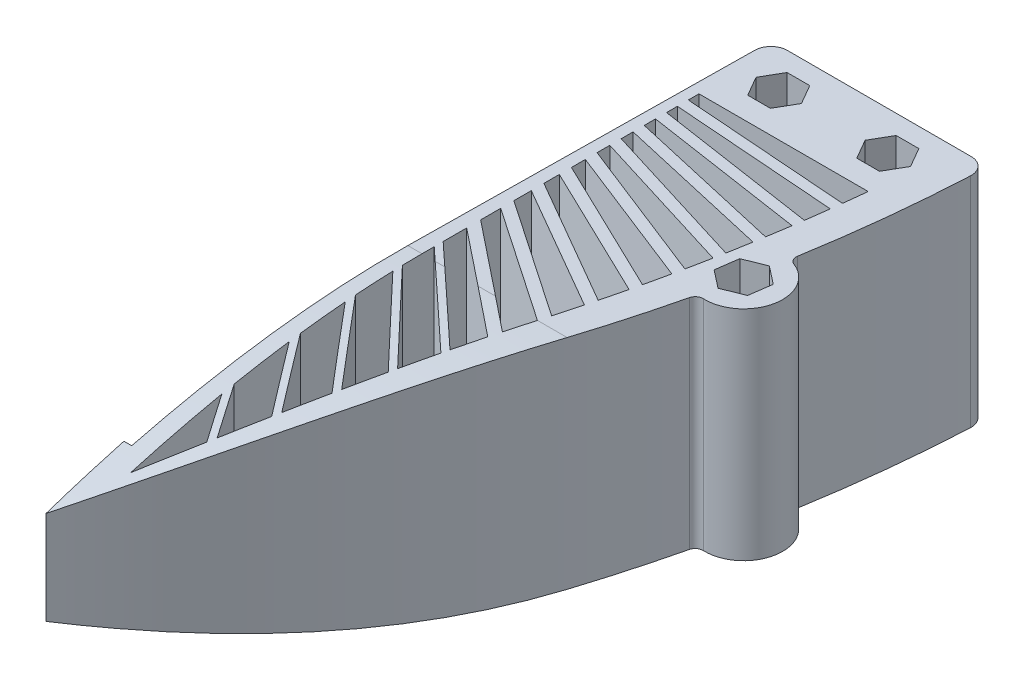
from build123d import *

# Parameters (mm, degrees)
SKETCH_3_R          = 2
EXTRUDE_2_DEPTH     = 40
SCALE_2_SCALE       = 0.7
EXTRUDE_START       = -28
EXTRUDE_3_DEPTH     = 28
SKETCH_6_R          = 1.5
CUT_EXTRUDE_4_DEPTH = 30
SKETCH_9_R          = 1.5
EXTRUDE_5_DEPTH     = 28
EXTRUDE_6_DEPTH     = 28
SKETCH_12_R         = 1.5
CUT_EXTRUDE_6_DEPTH = 37
CUT_EXTRUDE_8_DEPTH = 30
FILLET_1_R          = 1
CUT_EXTRUDE_7_DEPTH = 37


with BuildPart() as part:
    # 草图3 → 凸台-拉伸2 (new body)
    with BuildSketch(Plane(origin=(0, 0, 0), x_dir=(1, 0, 0), z_dir=(0, 1, 0))):
        with BuildLine():
            Line((0, 120.364670388), (0, 1))
            ThreePointArc((0, 1), (0.722246327, 0.039347671), (1.845705794, 0.466350574))
            ThreePointArc((1.845705794, 0.466350574), (20.84747072, 37.000481257), (33.527350269, 76.179945644))
            ThreePointArc((33.527350269, 76.179945644), (34.378342968, 77.668130682), (35.905349356, 78.447319216))
            ThreePointArc((35.905349356, 78.447319216), (39.900282258, 82.371073997), (37.749214417, 87.541010902))
            ThreePointArc((37.749214417, 87.541010902), (36.64631247, 88.853447787), (36.44219633, 90.555569958))
            ThreePointArc((36.44219633, 90.555569958), (38.528750421, 105.336074708), (39.720316086, 120.215496736))
            ThreePointArc((39.720316086, 120.215496736), (38.897448554, 122.432577427), (36.724027178, 123.364670388))
            Line((36.724027178, 123.364670388), (3, 123.364670388))
            ThreePointArc((3, 123.364670388), (0.878679656, 122.485990731), (0, 120.364670388))
        make_face()
        with Locations(Location((35, 83.364670388, 0), (0, 0, 270))):
            Circle(SKETCH_3_R, mode=Mode.SUBTRACT)
        with Locations(Location((35, 118.364670388, 0), (0, 0, 270))):
            Circle(SKETCH_3_R, mode=Mode.SUBTRACT)
        with Locations(Location((5, 118.364670388, 0), (0, 0, 270))):
            Circle(SKETCH_3_R, mode=Mode.SUBTRACT)
        with BuildLine():
            Line((6.404592978, 13.516926157), (1.8, 20.887532698))
            Line((1.8, 20.887532698), (1.8, 4.166952556))
            ThreePointArc((1.8, 4.166952556), (4.143731804, 8.821533656), (6.404592978, 13.516926157))
        make_face(mode=Mode.SUBTRACT)
        with BuildLine():
            Line((10.108701369, 21.710284842), (1.8, 33.238427229))
            Line((1.8, 33.238427229), (1.8, 23.152408171))
            Line((1.8, 23.152408171), (7.010340095, 14.812177672))
            ThreePointArc((7.010340095, 14.812177672), (8.581699979, 18.251269202), (10.108701369, 21.710284842))
        make_face(mode=Mode.SUBTRACT)
        with BuildLine():
            Line((13.360943276, 29.512867752), (1.8, 43.503052476))
            Line((1.8, 43.503052476), (1.8, 35.290776631))
            Line((1.8, 35.290776631), (10.66221999, 22.994639198))
            ThreePointArc((10.66221999, 22.994639198), (12.031133738, 26.245658374), (13.360943276, 29.512867752))
        make_face(mode=Mode.SUBTRACT)
        with BuildLine():
            Line((16.223970717, 36.961262948), (1.8, 52.237399724))
            Line((1.8, 52.237399724), (1.8, 45.386862205))
            Line((1.8, 45.386862205), (13.866413905, 30.784994912))
            ThreePointArc((13.866413905, 30.784994912), (15.062552919, 33.866502174), (16.223970717, 36.961262948))
        make_face(mode=Mode.SUBTRACT)
        with BuildLine():
            Line((18.75085734, 44.092608971), (1.8, 59.820076913))
            Line((1.8, 59.820076913), (1.8, 53.985305955))
            Line((1.8, 53.985305955), (16.685267787, 38.220618747))
            ThreePointArc((16.685267787, 38.220618747), (17.733603559, 41.151147004), (18.75085734, 44.092608971))
        make_face(mode=Mode.SUBTRACT)
        with BuildLine():
            Line((20.868191148, 50.566760797), (1.8, 65.772358036))
            Line((1.8, 65.772358036), (1.8, 61.457038549))
            Line((1.8, 61.457038549), (19.171511459, 45.339276238))
            ThreePointArc((19.171511459, 45.339276238), (20.032066674, 47.949053786), (20.868191148, 50.566760797))
        make_face(mode=Mode.SUBTRACT)
        with BuildLine():
            Line((22.974243013, 57.571710343), (1.8, 72.007377378))
            Line((1.8, 72.007377378), (1.8, 68.330403189))
            Line((1.8, 68.330403189), (21.504437212, 52.617442597))
            ThreePointArc((21.504437212, 52.617442597), (22.250225593, 55.091347023), (22.974243013, 57.571710343))
        make_face(mode=Mode.SUBTRACT)
        with BuildLine():
            Line((24.827629624, 64.328957972), (1.8, 77.623370722))
            Line((1.8, 77.623370722), (1.8, 74.427948576))
            Line((1.8, 74.427948576), (23.548915198, 59.600495336))
            ThreePointArc((23.548915198, 59.600495336), (24.198120154, 61.962063537), (24.827629624, 64.328957972))
        make_face(mode=Mode.SUBTRACT)
        with BuildLine():
            Line((26.461878816, 70.885143812), (1.8, 82.761173702))
            Line((1.8, 82.761173702), (1.8, 79.932745943))
            Line((1.8, 79.932745943), (25.345753049, 66.339207891))
            ThreePointArc((25.345753049, 66.339207891), (25.912863392, 68.609954504), (26.461878816, 70.885143812))
        make_face(mode=Mode.SUBTRACT)
        with BuildLine():
            Line((27.903926427, 77.284451229), (1.8, 87.529070114))
            Line((1.8, 87.529070114), (1.8, 84.980988462))
            Line((1.8, 84.980988462), (26.927669734, 72.880655026))
            ThreePointArc((26.927669734, 72.880655026), (27.424243887, 75.080680817), (27.903926427, 77.284451229))
        make_face(mode=Mode.SUBTRACT)
        with BuildLine():
            Line((29.175137635, 83.569053675), (1.8, 92.012833113))
            Line((1.8, 92.012833113), (1.8, 89.677577503))
            Line((1.8, 89.677577503), (28.320844309, 79.269337072))
            ThreePointArc((28.320844309, 79.269337072), (28.756005088, 81.417603081), (29.175137635, 83.569053675))
        make_face(mode=Mode.SUBTRACT)
        with BuildLine():
            Line((30.292091958, 89.779646522), (1.8, 96.282531447))
            Line((1.8, 96.282531447), (1.8, 94.105811431))
            Line((1.8, 94.105811431), (29.545931615, 85.547661697))
            ThreePointArc((29.545931615, 85.547661697), (29.926744008, 87.662290807), (30.292091958, 89.779646522))
        make_face(mode=Mode.SUBTRACT)
        with BuildLine():
            Line((31.267160482, 95.956031632), (1.8, 100.397324466))
            Line((1.8, 100.397324466), (1.8, 98.333961282))
            Line((1.8, 98.333961282), (30.618838123, 91.756501534))
            ThreePointArc((30.618838123, 91.756501534), (30.950586551, 93.855095266), (31.267160482, 95.956031632))
        make_face(mode=Mode.SUBTRACT)
        with BuildLine():
            Line((32.108897466, 102.137737837), (1.8, 104.408991264))
            Line((1.8, 104.408991264), (1.8, 102.419913444))
            Line((1.8, 102.419913444), (31.551287828, 97.935796913))
            ThreePointArc((31.551287828, 97.935796913), (31.837665489, 100.035762437), (32.108897466, 102.137737837))
        make_face(mode=Mode.SUBTRACT)
        with BuildLine():
            Line((32.822260718, 108.364670388), (1.8, 108.364670388))
            Line((1.8, 108.364670388), (1.8, 106.414598935))
            Line((1.8, 106.414598935), (32.351201095, 104.125188036))
            ThreePointArc((32.351201095, 104.125188036), (32.594419706, 106.24407489), (32.822260718, 108.364670388))
        make_face(mode=Mode.SUBTRACT)
        with BuildLine():
            Line((1.8, 110.364670388), (33.02290127, 110.364670388))
            ThreePointArc((33.02290127, 110.364670388), (33.164293245, 111.864318022), (33.298, 113.364670388))
            Line((33.298, 113.364670388), (1.8, 113.364670388))
            Line((1.8, 113.364670388), (1.8, 110.364670388))
        make_face(mode=Mode.SUBTRACT)
    extrude(amount=EXTRUDE_2_DEPTH)


with BuildPart() as part_1:
    # 缩放比例2: scaled about (17.639096178, 20, -80.17321458)
    add(part.part.scale(SCALE_2_SCALE).moved(Location((5.291728853, 6, -24.051964374))))

    # 草图7 → 凸台-拉伸3 (add)
    with BuildSketch(Plane(origin=(0, 34, 0), x_dir=(1, 0, 0), z_dir=(0, 1, 0)).offset(EXTRUDE_START)):
        with BuildLine():
            Line((3.291728853, 19.356429269), (3.291728853, 29.356429269))
            Line((3.291728853, 29.356429269), (4.291728853, 29.356429269))
            Line((4.291728853, 29.356429269), (5.291728853, 108.307233646))
            Line((5.291728853, 108.307233646), (5.291728853, 24.751964374))
            ThreePointArc((5.291728853, 24.751964374), (5.797301282, 24.079507744), (6.583722909, 24.378409776))
            ThreePointArc((6.583722909, 24.378409776), (4.959489095, 21.853153364), (3.291728853, 19.356429269))
        make_face()
    extrude(amount=EXTRUDE_3_DEPTH)

    # 草图6 → 切除-拉伸4 (cut)
    with BuildSketch(Plane(origin=(0, 34, 0), x_dir=(1, 0, 0), z_dir=(0, 1, 0))):
        with Locations(Location((8.791728853, 106.907233646, 0), (0, 0, 270))):
            Circle(SKETCH_6_R)
        with Locations(Location((29.791728853, 106.907233646, 0), (0, 0, 270))):
            Circle(SKETCH_6_R)
        with Locations(Location((29.791728853, 82.407233646, 0), (0, 0, 270))):
            Circle(SKETCH_6_R)
    extrude(amount=-CUT_EXTRUDE_4_DEPTH, mode=Mode.SUBTRACT)

    # 草图9 → 凸台-拉伸5 (add)
    with BuildSketch(Plane(origin=(0, 34, 0), x_dir=(1, 0, 0), z_dir=(0, 1, 0))):
        with Locations((29.791728853, 106.907233646)):
            Circle(SKETCH_9_R)
        with Locations((8.791728853, 106.907233646)):
            Circle(SKETCH_9_R)
    extrude(amount=-EXTRUDE_5_DEPTH)

    # 草图17 → 凸台-拉伸6 (add)
    with BuildSketch(Plane(origin=(0, 34, 0), x_dir=(1, 0, 0), z_dir=(0, 1, 0)).offset(EXTRUDE_START)):
        with BuildLine():
            Line((28.600328853, 103.407233646), (6.551728853, 103.407233646))
            Line((6.551728853, 103.407233646), (6.551728853, 101.307233646))
            Line((6.551728853, 101.307233646), (28.407759742, 101.307233646))
            ThreePointArc((28.407759742, 101.307233646), (28.506734125, 102.35698699), (28.600328853, 103.407233646))
        make_face()
        with BuildLine():
            ThreePointArc((28.7955625, 77.507473183), (34.692011112, 81.413637254), (30.782755009, 87.308036351))
            ThreePointArc((30.782755009, 87.308036351), (30.97180395, 86.188282069), (31.716178945, 85.330672006))
            ThreePointArc((31.716178945, 85.330672006), (33.221926434, 81.711716172), (30.425473403, 78.965087826))
            ThreePointArc((30.425473403, 78.965087826), (29.405838578, 78.465153851), (28.7955625, 77.507473183))
        make_face()
    extrude(amount=EXTRUDE_6_DEPTH)

    # 草图12 → 切除-拉伸6 (cut)
    with BuildSketch(Plane(origin=(0, 34, 0), x_dir=(1, 0, 0), z_dir=(0, 1, 0))):
        with Locations(Location((11.291728853, 105.407233646, 0), (0, 0, 270))):
            Circle(SKETCH_12_R)
        with Locations(Location((25.291728853, 105.407233646, 0), (0, 0, 270))):
            Circle(SKETCH_12_R)
    extrude(amount=-CUT_EXTRUDE_6_DEPTH, mode=Mode.SUBTRACT)

    # 草图18 → 切除-拉伸8 (cut)
    with BuildSketch(Plane(origin=(0, 34, 0), x_dir=(1, 0, 0), z_dir=(0, 1, 0))):
        Polygon((12.749538283, 102.882233646), (14.207347713, 105.407233646), (12.749538283, 107.932233646), (9.833919424, 107.932233646), (8.376109994, 105.407233646), (9.833919424, 102.882233646), align=None)
        Polygon((26.749538283, 102.882233646), (28.207347713, 105.407233646), (26.749538283, 107.932233646), (23.833919424, 107.932233646), (22.376109994, 105.407233646), (23.833919424, 102.882233646), align=None)
        Polygon((32.495043586, 83.499443694), (30.197504571, 85.294477903), (27.494189839, 84.202267854), (27.088414121, 81.315023597), (29.385953135, 79.519989389), (32.089267868, 80.612199437), align=None)
    extrude(amount=-CUT_EXTRUDE_8_DEPTH, mode=Mode.SUBTRACT)

    # 圆角1
    fillet_1_edges = [part_1.edges().sort_by_distance(p)[0] for p in [
        (28.7955625, 20, -77.507473183),
        (30.782755009, 20, -87.308036351),
    ]]
    fillet(fillet_1_edges, radius=FILLET_1_R)

    # 草图13 → 切除-拉伸7 (cut)
    with BuildSketch(Plane.ZY.offset(-3.291728853)):
        with BuildLine():
            Line((-29.356429269, 34), (-64.356429269, 34))
            add(Edge.make_bspline(
                [(-64.356429269, 34), (-47.72274735, 34), (-29.356429269, 29.03082782)],
                knots=[0.08514386, 0.08514386, 0.08514386, 0.806168052, 0.806168052, 0.806168052], degree=2))
            Line((-29.356429269, 29.03082782), (-29.356429269, 34))
        make_face()
        with BuildLine():
            Line((-19.356429269, 34), (-29.356429269, 34))
            Line((-29.356429269, 34), (-29.356429269, 29.03082782))
            add(Edge.make_bspline(
                [(-29.356429269, 29.03082782), (-24.419037067, 27.694972051), (-19.356429269, 26)],
                knots=[0.806168052, 0.806168052, 0.806168052, 1, 1, 1], degree=2))
            Line((-19.356429269, 26), (-19.356429269, 34))
        make_face()
        with BuildLine():
            add(Edge.make_bspline(
                [(-64.356429269, 6), (-43.251137361, 6), (-19.356429269, 14)],
                knots=[0.08514386, 0.08514386, 0.08514386, 1, 1, 1], degree=2))
            Line((-19.356429269, 14), (-19.356429269, 6))
            Line((-19.356429269, 6), (-64.356429269, 6))
        make_face()
    extrude(amount=-CUT_EXTRUDE_7_DEPTH, mode=Mode.SUBTRACT)


solid = part_1.part
